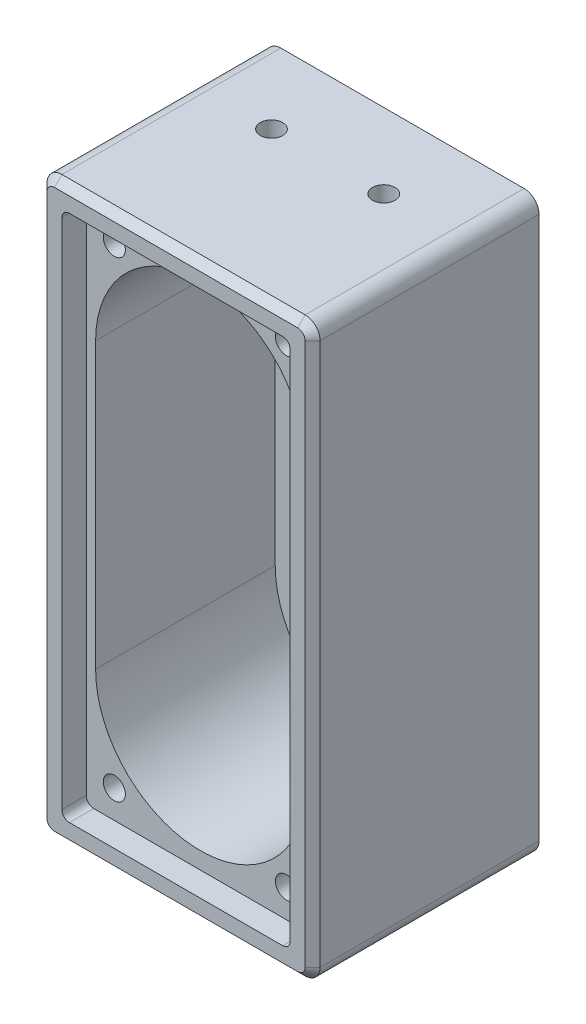
from build123d import *

# Parameters (mm, degrees)
BASE_SKETCH_W           = 36.5
BASE_SKETCH_H           = 76.5
BASE_SKETCH_W_2         = 30.5
BASE_SKETCH_H_2         = 70.5
BASE_SKETCH_R           = 1.475
BOSS_EXTRUDE1_DEPTH     = 3
BOSS_EXTRUDE2_START     = 3
BASE_SKETCH_8_W         = 36.5
BASE_SKETCH_8_H         = 76.5
BASE_SKETCH_8_W_2       = 30.5
BASE_SKETCH_8_H_2       = 70.5
BASE_SKETCH_8_R         = 1.475
BOSS_EXTRUDE2_DEPTH     = 24
BOSS_EXTRUDE3_START     = 27
BASE_SKETCH_9_W         = 36.5
BASE_SKETCH_9_H         = 76.5
BASE_SKETCH_9_W_2       = 30.5
BASE_SKETCH_9_H_2       = 70.5
BOSS_EXTRUDE3_DEPTH     = 3.25
FILLET1_R               = 2
FILLET2_R               = 1
CHAMFER1_SIZE           = 1
CUT_EXTRUDE1_REACH      = 86.264
CUT_EXTRUDE1_END_RADIUS = 14
SKETCH1_R               = 1.5


with BuildPart() as part:
    # Base_Sketch → Boss-Extrude1 (new body)
    # profile 1 of 7: a face of its own
    with BuildSketch(Plane.XY):
        Rectangle(BASE_SKETCH_W, BASE_SKETCH_H)
        Rectangle(BASE_SKETCH_W_2, BASE_SKETCH_H_2, mode=Mode.SUBTRACT)
    # profile 2 of 7: a face of its own
    with BuildSketch(Plane.XY):
        Rectangle(BASE_SKETCH_W_2, BASE_SKETCH_H_2)
        with Locations((-11.5, -31.5)):
            Circle(BASE_SKETCH_R, mode=Mode.SUBTRACT)
        with Locations((11.5, -31.5)):
            Circle(BASE_SKETCH_R, mode=Mode.SUBTRACT)
        with Locations((11.5, 31.5)):
            Circle(BASE_SKETCH_R, mode=Mode.SUBTRACT)
        with Locations((-11.5, 31.5)):
            Circle(BASE_SKETCH_R, mode=Mode.SUBTRACT)
        with BuildLine():
            ThreePointArc((-14, -19), (0, -33), (14, -19))
            Line((14, -19), (14, 19))
            ThreePointArc((14, 19), (0, 33), (-14, 19))
            Line((-14, 19), (-14, -19))
        make_face(mode=Mode.SUBTRACT)
    # profile 3 of 7: a face of its own
    with BuildSketch(Plane.XY):
        with Locations((-11.5, -31.5)):
            Circle(BASE_SKETCH_R)
    # profile 4 of 7: a face of its own
    with BuildSketch(Plane.XY):
        with Locations((11.5, -31.5)):
            Circle(BASE_SKETCH_R)
    # profile 5 of 7: a face of its own
    with BuildSketch(Plane.XY):
        with Locations((11.5, 31.5)):
            Circle(BASE_SKETCH_R)
    # profile 6 of 7: a face of its own
    with BuildSketch(Plane.XY):
        with Locations((-11.5, 31.5)):
            Circle(BASE_SKETCH_R)
    # profile 7 of 7: a face of its own
    with BuildSketch(Plane.XY):
        with BuildLine():
            Line((-14, 19), (-14, -19))
            ThreePointArc((-14, -19), (0, -33), (14, -19))
            Line((14, -19), (14, 19))
            ThreePointArc((14, 19), (0, 33), (-14, 19))
        make_face()
    extrude(amount=BOSS_EXTRUDE1_DEPTH)

    # Base_Sketch<8> → Boss-Extrude2 (add)
    # profile 1 of 2: a face of its own
    with BuildSketch(Plane.XY.offset(BOSS_EXTRUDE2_START)):
        Rectangle(BASE_SKETCH_8_W, BASE_SKETCH_8_H)
        Rectangle(BASE_SKETCH_8_W_2, BASE_SKETCH_8_H_2, mode=Mode.SUBTRACT)
    # profile 2 of 2: a face of its own
    with BuildSketch(Plane.XY.offset(BOSS_EXTRUDE2_START)):
        Rectangle(BASE_SKETCH_8_W_2, BASE_SKETCH_8_H_2)
        with Locations((-11.5, -31.5)):
            Circle(BASE_SKETCH_8_R, mode=Mode.SUBTRACT)
        with Locations((11.5, -31.5)):
            Circle(BASE_SKETCH_8_R, mode=Mode.SUBTRACT)
        with Locations((11.5, 31.5)):
            Circle(BASE_SKETCH_8_R, mode=Mode.SUBTRACT)
        with Locations((-11.5, 31.5)):
            Circle(BASE_SKETCH_8_R, mode=Mode.SUBTRACT)
        with BuildLine():
            ThreePointArc((-14, -19), (0, -33), (14, -19))
            Line((14, -19), (14, 19))
            ThreePointArc((14, 19), (0, 33), (-14, 19))
            Line((-14, 19), (-14, -19))
        make_face(mode=Mode.SUBTRACT)
    extrude(amount=BOSS_EXTRUDE2_DEPTH)

    # Base_Sketch<9> → Boss-Extrude3 (add)
    with BuildSketch(Plane.XY.offset(BOSS_EXTRUDE3_START)):
        Rectangle(BASE_SKETCH_9_W, BASE_SKETCH_9_H)
        Rectangle(BASE_SKETCH_9_W_2, BASE_SKETCH_9_H_2, mode=Mode.SUBTRACT)
    extrude(amount=BOSS_EXTRUDE3_DEPTH)

    # Fillet1
    fillet1_edges = [part.edges().sort_by_distance(p)[0] for p in [
        (-18.25, 38.25, 15.125),
        (18.25, 38.25, 15.125),
        (18.25, -38.25, 15.125),
        (-18.25, -38.25, 15.125),
    ]]
    fillet(fillet1_edges, radius=FILLET1_R)

    # Fillet2
    fillet2_edges = [part.edges().sort_by_distance(p)[0] for p in [
        (-15.25, 35.25, 28.625),
        (-15.25, -35.25, 28.625),
        (15.25, -35.25, 28.625),
        (15.25, 35.25, 28.625),
    ]]
    fillet(fillet2_edges, radius=FILLET2_R)

    # Chamfer1
    chamfer1_edges = [part.edges().sort_by_distance(p)[0] for p in [
        (0, -38.25, 30.25),
        (-18.25, 0, 30.25),
        (18.25, 0, 30.25),
        (0, 38.25, 30.25),
        (17.664213562, -37.664213562, 30.25),
        (17.664213562, 37.664213562, 30.25),
        (-17.664213562, 37.664213562, 30.25),
        (-17.664213562, -37.664213562, 30.25),
    ]]
    chamfer(chamfer1_edges, length=CHAMFER1_SIZE)

    # Cut-Extrude1: up to this cylinder (the profile starts outside it)
    cut_extrude1_end = Plane(origin=(0, 19, 10), z_dir=(0, 0, -1)) * Cylinder(CUT_EXTRUDE1_END_RADIUS, 201.528, mode=Mode.PRIVATE)
    # Sketch1 → Cut-Extrude1 (cut, up to the surface)
    with BuildSketch(Plane(origin=(0, 38.25, 0), x_dir=(1, 0, 0), z_dir=(0, 1, 0)), mode=Mode.PRIVATE) as cut_extrude1_sk1:
        with Locations(Location((-7.5, -10, 0), (0, 0, 270))):
            Circle(SKETCH1_R)
    cut_extrude1_tool1 = extrude(cut_extrude1_sk1.sketch, amount=-CUT_EXTRUDE1_REACH, mode=Mode.PRIVATE) - cut_extrude1_end
    add(cut_extrude1_tool1.solids().sort_by_distance((-7.5, 38.25, 10))[0], mode=Mode.SUBTRACT)
    # Sketch1 → Cut-Extrude1 (cut, up to the surface)
    with BuildSketch(Plane(origin=(0, 38.25, 0), x_dir=(1, 0, 0), z_dir=(0, 1, 0)), mode=Mode.PRIVATE) as cut_extrude1_sk2:
        with Locations(Location((7.5, -10, 0), (0, 0, 270))):
            Circle(SKETCH1_R)
    cut_extrude1_tool2 = extrude(cut_extrude1_sk2.sketch, amount=-CUT_EXTRUDE1_REACH, mode=Mode.PRIVATE) - cut_extrude1_end
    add(cut_extrude1_tool2.solids().sort_by_distance((7.5, 38.25, 10))[0], mode=Mode.SUBTRACT)


solid = part.part
